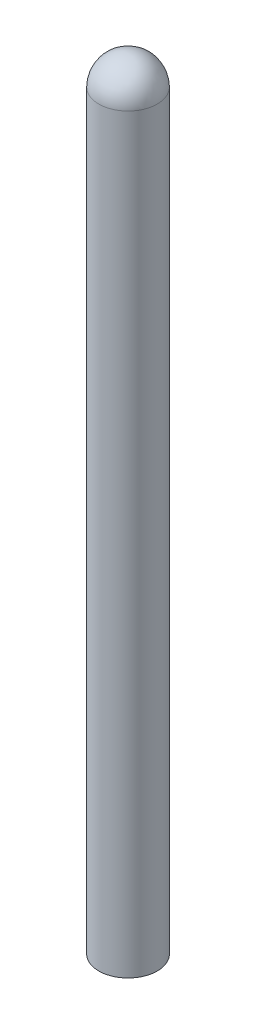
from build123d import *

# Parameters (mm, degrees)
SKETCH1_R      = 2.38125
EXTRUDE1_DEPTH = 63.5
FILLET1_R      = 2.38125


with BuildPart() as part:
    # Sketch1 → Extrude1 (new body)
    with BuildSketch(Plane(origin=(0, 0, 0), x_dir=(1, 0, 0), z_dir=(0, 1, 0))):
        with Locations(Location((0, 0, 0), (0, 0, 270))):
            Circle(SKETCH1_R)
    extrude(amount=EXTRUDE1_DEPTH)

    # Fillet1
    fillet1_edges = [part.edges().sort_by_distance(p)[0] for p in [
        (0, 63.5, -2.38125),
    ]]
    fillet(fillet1_edges, radius=FILLET1_R)


solid = part.part
